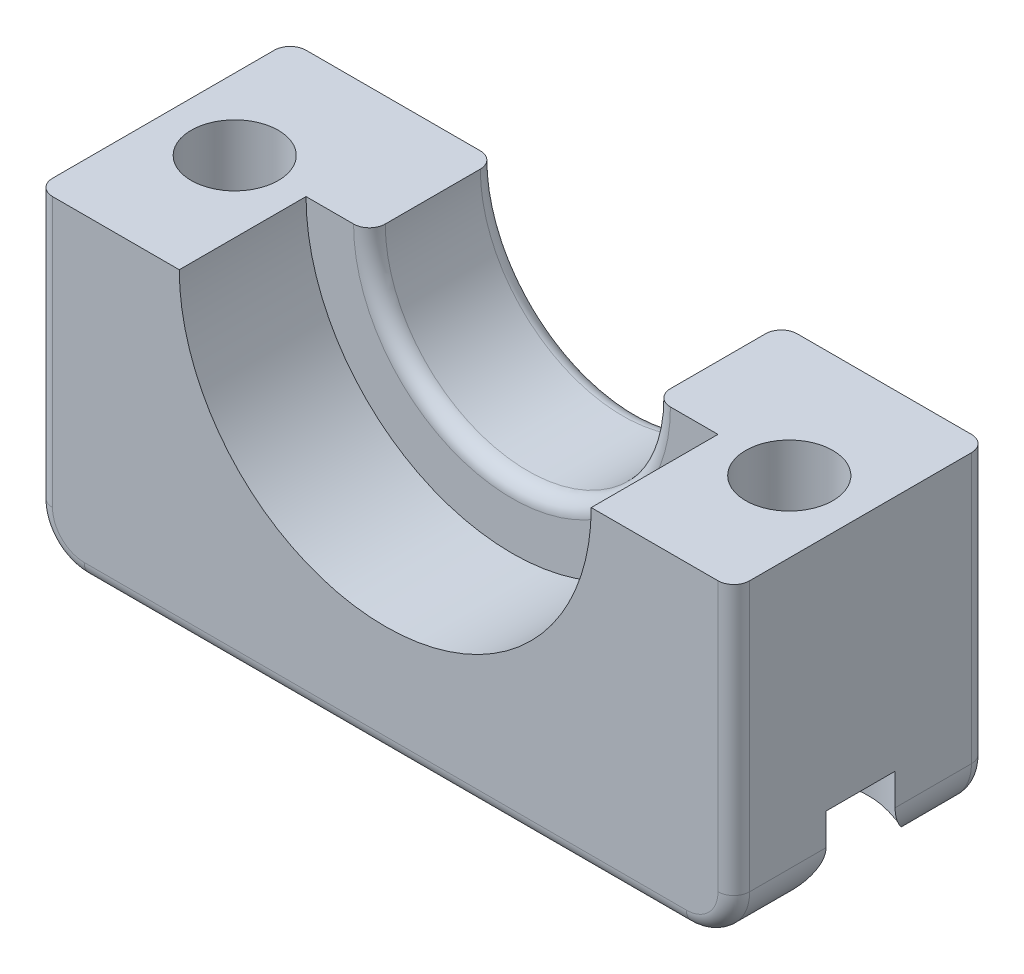
from build123d import *

# Parameters (mm, degrees)
SZKIC1_W                                          = 22
SZKIC1_H                                          = 20
DODANIE_WYCI_GNI_CIE1_DEPTH                       = 8
WYTNIJ_WYCI_GNI_CIE1_DEPTH                        = 8
WYTNIJ_WYCI_GNI_CIE2_DEPTH                        = 31.789608637
WYTNIJ_WYCI_GNI_CIE2_DEPTH_BACK                   = 31.789608637
POG_BIENIE_WALCOWE_POD_M5_RUB_Z_BEM_W_D           = 5.5
POG_BIENIE_WALCOWE_POD_M5_RUB_Z_BEM_W_CBORE_D     = 10
POG_BIENIE_WALCOWE_POD_M5_RUB_Z_BEM_W_CBORE_DEPTH = 5
ZAOKR_GLENIE1_R                                   = 3
ZAOKR_GLENIE2_R                                   = 1


with BuildPart() as part:
    # Szkic1 → Dodanie-wyciągnięcie1 (new, symmetric)
    with BuildSketch(Plane.XY):
        with Locations((11, 10)):
            Rectangle(SZKIC1_W, SZKIC1_H)
    dodanie_wyci_gni_cie1 = extrude(amount=DODANIE_WYCI_GNI_CIE1_DEPTH, both=True)

    # Lustro1: Dodanie-wyciągnięcie1 across plane
    add(dodanie_wyci_gni_cie1.mirror(Plane(origin=(0, 20, 8), x_dir=(0, 0, 1), z_dir=(1, 0, 0))))

    # Szkic2 → Wytnij-wyciągnięcie1 (cut)
    with BuildSketch(Plane.XY.offset(8)):
        with BuildLine():
            Line((-13, 20), (13, 20))
            ThreePointArc((13, 20), (0, 7), (-13, 20))
        make_face()
    extrude(amount=-WYTNIJ_WYCI_GNI_CIE1_DEPTH, mode=Mode.SUBTRACT)

    # Szkic3 → Wytnij-wyciągnięcie2 (cut, two sides: drawn at the far end of the back side and taken through both)
    with BuildSketch(Plane.XY.offset(-WYTNIJ_WYCI_GNI_CIE2_DEPTH_BACK)):
        with BuildLine():
            ThreePointArc((-9, 20), (0, 11), (9, 20))
            Line((9, 20), (-9, 20))
        make_face()
    extrude(amount=WYTNIJ_WYCI_GNI_CIE2_DEPTH + WYTNIJ_WYCI_GNI_CIE2_DEPTH_BACK, mode=Mode.SUBTRACT)

    # Pogłębienie walcowe pod M5 Śrubę z łbem walcowym z gniazdem1 (through all)
    with Locations(Plane(origin=(0, 0, 0), x_dir=(-1, 0, 0), z_dir=(0, -1, 0))):
        with Locations((-17.5, 0), (17.5, 0)):
            CounterBoreHole(POG_BIENIE_WALCOWE_POD_M5_RUB_Z_BEM_W_D / 2, POG_BIENIE_WALCOWE_POD_M5_RUB_Z_BEM_W_CBORE_D / 2, POG_BIENIE_WALCOWE_POD_M5_RUB_Z_BEM_W_CBORE_DEPTH)

    # Zaokrąglenie1
    zaokr_glenie1_edges = [part.edges().sort_by_distance(p)[0] for p in [
        (-22, 0, 5.089724736),
        (-22, 0, -5.089724736),
        (22, 0, -5.089724736),
        (22, 0, 5.089724736),
    ]]
    fillet(zaokr_glenie1_edges, radius=ZAOKR_GLENIE1_R)

    # Zaokrąglenie2
    zaokr_glenie2_edges = [part.edges().sort_by_distance(p)[0] for p in [
        (-22, 11.5, 8),
        (-21.121320344, 0.878679656, 8),
        (0, 0, 8),
        (21.121320344, 0.878679656, 8),
        (0, 0, -8),
        (0, 11, -8),
        (22, 11.5, 8),
        (0, 11, 0),
        (22, 11.5, -8),
        (-21.121320344, 0.878679656, -8),
        (21.121320344, 0.878679656, -8),
    ]]
    fillet(zaokr_glenie2_edges, radius=ZAOKR_GLENIE2_R)


solid = part.part
